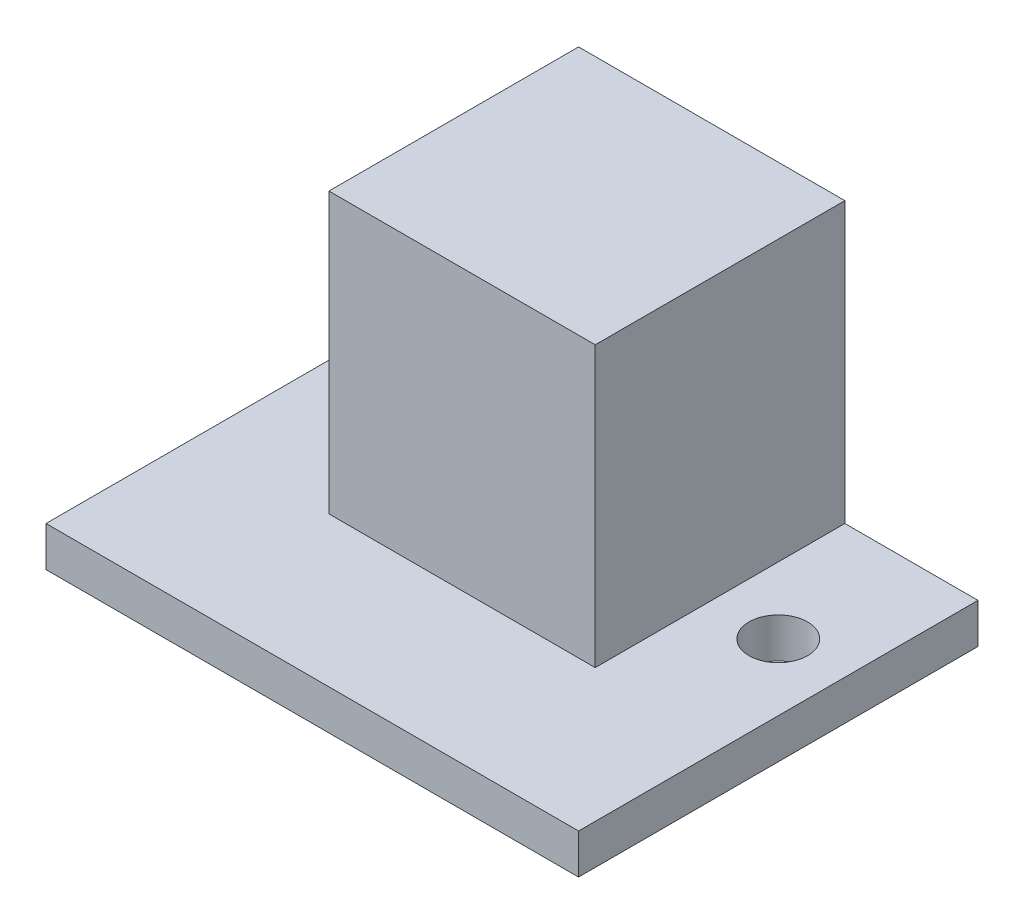
from build123d import *

# Parameters (mm, degrees)
ESQUISSE3_W        = 10
ESQUISSE3_H        = 15
ESQUISSE3_H_2      = 10
ESQUISSE3_H_3      = 5
BOSS_EXTRU_1_DEPTH = 3
ESQUISSE4_W        = 10
ESQUISSE4_H        = 5
ESQUISSE4_H_2      = 3.75
BOSS_EXTRU_2_DEPTH = 17
ESQUISSE5_W        = 20
ESQUISSE5_H        = 18.75
BOSS_EXTRU_4_DEPTH = 4


with BuildPart() as part:
    # Esquisse3 → Boss.-Extru.1 (new body)
    with BuildSketch(Plane(origin=(0, 0, 0), x_dir=(1, 0, 0), z_dir=(0, 1, 0))):
        with Locations((-15.05164944, -6.870348765)):
            Rectangle(ESQUISSE3_W, ESQUISSE3_H)
        with Locations((14.94835056, -6.870348765)):
            Rectangle(ESQUISSE3_W, ESQUISSE3_H)
        with BuildLine():
            Line((-10.05164944, 5.629651235), (-10.05164944, 15.629651235))
            Line((-10.05164944, 15.629651235), (-20.05164944, 15.629651235))
            Line((-20.05164944, 15.629651235), (-20.05164944, 5.629651235))
            Line((-20.05164944, 5.629651235), (-17.25164944, 5.629651235))
            ThreePointArc((-17.25164944, 5.629651235), (-15.05164944, 7.829651235), (-12.85164944, 5.629651235))
            Line((-12.85164944, 5.629651235), (-10.05164944, 5.629651235))
        make_face()
        with BuildLine():
            Line((-10.05164944, 0.629651235), (-10.05164944, 5.629651235))
            Line((-10.05164944, 5.629651235), (-12.85164944, 5.629651235))
            ThreePointArc((-12.85164944, 5.629651235), (-15.05164944, 3.429651235), (-17.25164944, 5.629651235))
            Line((-17.25164944, 5.629651235), (-20.05164944, 5.629651235))
            Line((-20.05164944, 5.629651235), (-20.05164944, 0.629651235))
            Line((-20.05164944, 0.629651235), (-10.05164944, 0.629651235))
        make_face()
        with Locations((-5.05164944, 10.629651235)):
            Rectangle(ESQUISSE3_W, ESQUISSE3_H_2)
        with Locations((4.94835056, 10.629651235)):
            Rectangle(ESQUISSE3_W, ESQUISSE3_H_2)
        with BuildLine():
            Line((19.94835056, 15.629651235), (9.94835056, 15.629651235))
            Line((9.94835056, 15.629651235), (9.94835056, 5.629651235))
            Line((9.94835056, 5.629651235), (12.74835056, 5.629651235))
            ThreePointArc((12.74835056, 5.629651235), (14.94835056, 7.829651235), (17.14835056, 5.629651235))
            Line((17.14835056, 5.629651235), (19.94835056, 5.629651235))
            Line((19.94835056, 5.629651235), (19.94835056, 15.629651235))
        make_face()
        with BuildLine():
            Line((12.74835056, 5.629651235), (9.94835056, 5.629651235))
            Line((9.94835056, 5.629651235), (9.94835056, 0.629651235))
            Line((9.94835056, 0.629651235), (19.94835056, 0.629651235))
            Line((19.94835056, 0.629651235), (19.94835056, 5.629651235))
            Line((19.94835056, 5.629651235), (17.14835056, 5.629651235))
            ThreePointArc((17.14835056, 5.629651235), (14.94835056, 3.429651235), (12.74835056, 5.629651235))
        make_face()
        with Locations((4.94835056, -6.870348765)):
            Rectangle(ESQUISSE3_W, ESQUISSE3_H)
        with Locations((-5.05164944, -6.870348765)):
            Rectangle(ESQUISSE3_W, ESQUISSE3_H)
        with Locations((4.94835056, 3.129651235)):
            Rectangle(ESQUISSE3_W, ESQUISSE3_H_3)
        with Locations((-5.05164944, 3.129651235)):
            Rectangle(ESQUISSE3_W, ESQUISSE3_H_3)
    extrude(amount=BOSS_EXTRU_1_DEPTH)

    # Esquisse4 → Boss.-Extru.2 (add)
    with BuildSketch(Plane(origin=(0, 3, 0), x_dir=(1, 0, 0), z_dir=(0, 1, 0))):
        with Locations((-5.05164944, 3.129651235)):
            Rectangle(ESQUISSE4_W, ESQUISSE4_H)
        with Locations((-5.05164944, -1.245348765)):
            Rectangle(ESQUISSE4_W, ESQUISSE4_H_2)
        with Locations((4.94835056, -1.245348765)):
            Rectangle(ESQUISSE4_W, ESQUISSE4_H_2)
        with Locations((4.94835056, 3.129651235)):
            Rectangle(ESQUISSE4_W, ESQUISSE4_H)
        Polygon((-0.05164944, 15.629651235), (-0.05164944, 5.629651235), (9.94835056, 5.629651235), (9.94835056, 8.129651235), align=None)
        Polygon((-10.05164944, 8.129651235), (-10.05164944, 5.629651235), (-0.05164944, 5.629651235), (-0.05164944, 15.629651235), align=None)
        Polygon((-10.05164944, 15.629651235), (-10.05164944, 8.129651235), (-0.05164944, 15.629651235), align=None)
        Polygon((9.94835056, 15.629651235), (-0.05164944, 15.629651235), (9.94835056, 8.129651235), align=None)
    extrude(amount=BOSS_EXTRU_2_DEPTH)

    # Esquisse5 → Boss.-Extru.4 (add)
    with BuildSketch(Plane(origin=(0, 20, 0), x_dir=(1, 0, 0), z_dir=(0, 1, 0))):
        with Locations((-0.05164944, 6.254651235)):
            Rectangle(ESQUISSE5_W, ESQUISSE5_H)
    extrude(amount=BOSS_EXTRU_4_DEPTH)


solid = part.part
